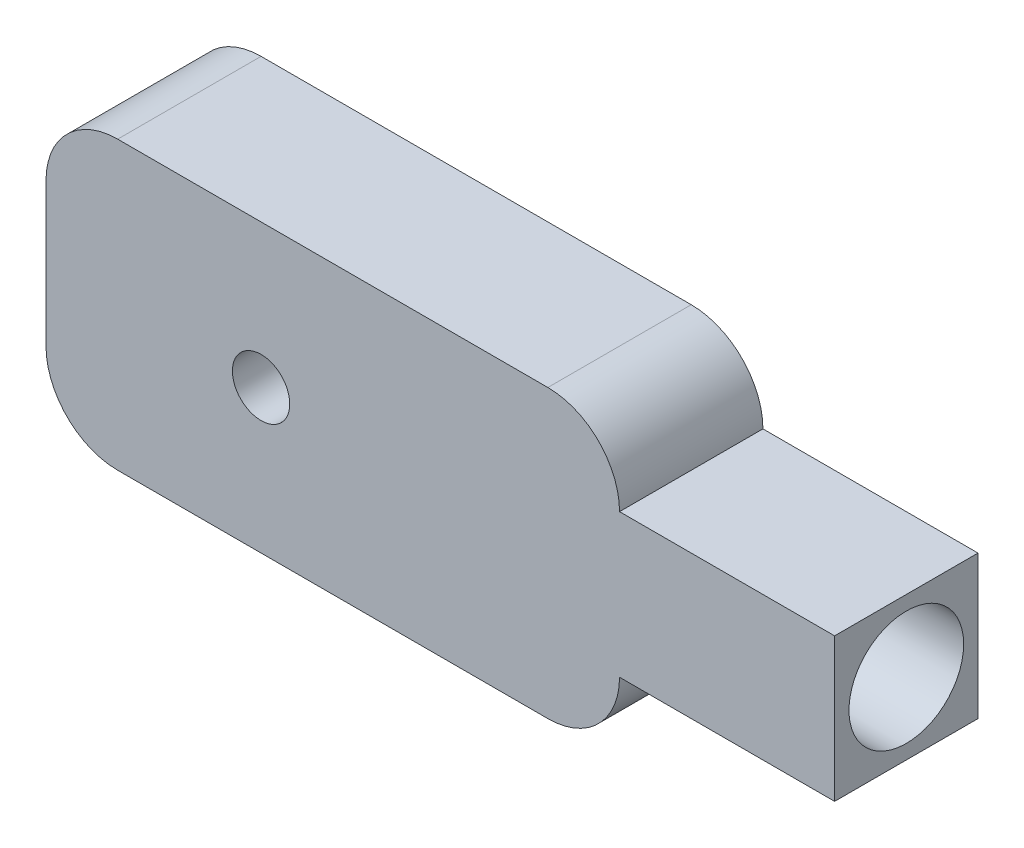
from build123d import *

# Parameters (mm, degrees)
SKETCH2_W           = 50.8
SKETCH2_H           = 25.4
BOSS_EXTRUDE1_DEPTH = 12.7
FILLET1_R           = 6.35
SKETCH3_R           = 2.54
CUT_EXTRUDE1_DEPTH  = 32.108519733
SKETCH4_W           = 12.7
SKETCH4_H           = 12.7
BOSS_EXTRUDE2_DEPTH = 19.05
SKETCH5_R           = 5.08
CUT_EXTRUDE2_DEPTH  = 25.4


with BuildPart() as part:
    # Sketch2 → Boss-Extrude1 (new body)
    with BuildSketch(Plane.XY):
        Rectangle(SKETCH2_W, SKETCH2_H)
    extrude(amount=BOSS_EXTRUDE1_DEPTH)

    # Fillet1
    fillet1_edges = [part.edges().sort_by_distance(p)[0] for p in [
        (-25.4, 12.7, 6.35),
        (25.4, 12.7, 6.35),
        (25.4, -12.7, 6.35),
        (-25.4, -12.7, 6.35),
    ]]
    fillet(fillet1_edges, radius=FILLET1_R)

    # Sketch3 → Cut-Extrude1 (cut, through all)
    with BuildSketch(Plane.XY.offset(12.7)):
        with Locations((-6.35, 0)):
            Circle(SKETCH3_R)
    extrude(amount=-CUT_EXTRUDE1_DEPTH, mode=Mode.SUBTRACT)

    # Sketch4 → Boss-Extrude2 (add)
    with BuildSketch(Plane(origin=(25.4, 0, 0), x_dir=(0, 0, -1), z_dir=(1, 0, 0))):
        with Locations((-6.35, 0)):
            Rectangle(SKETCH4_W, SKETCH4_H)
    extrude(amount=BOSS_EXTRUDE2_DEPTH)

    # Sketch5 → Cut-Extrude2 (cut)
    with BuildSketch(Plane(origin=(44.45, 0, 0), x_dir=(0, 0, -1), z_dir=(1, 0, 0))):
        with Locations((-6.35, 0)):
            Circle(SKETCH5_R)
    extrude(amount=-CUT_EXTRUDE2_DEPTH, mode=Mode.SUBTRACT)


solid = part.part
